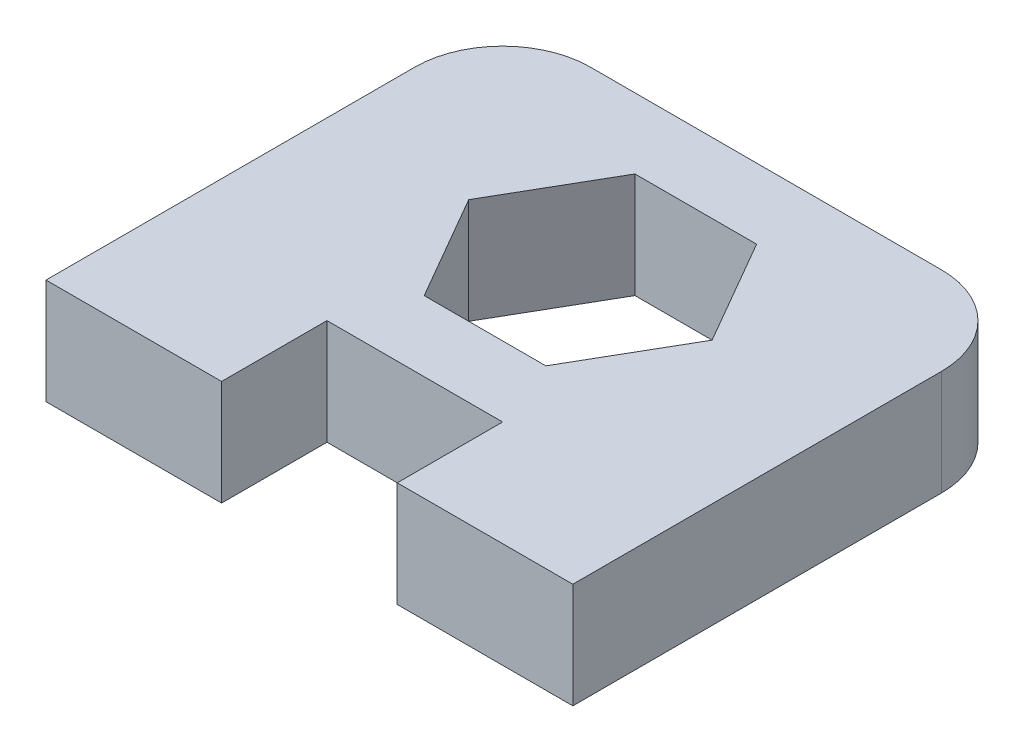
from build123d import *

# Parameters (mm, degrees)
BOSS_EXTRUDE1_DEPTH = 3


with BuildPart() as part:
    # Sketch1 → Boss-Extrude1 (new body)
    with BuildSketch(Plane(origin=(0, 0, 0), x_dir=(1, 0, 0), z_dir=(0, 1, 0))):
        with BuildLine():
            Line((0, 0), (0, 10.5))
            ThreePointArc((0, 10.5), (0.732233047, 12.267766953), (2.5, 13))
            Line((2.5, 13), (12.5, 13))
            ThreePointArc((12.5, 13), (14.267766953, 12.267766953), (15, 10.5))
            Line((15, 10.5), (15, 0))
            Line((15, 0), (10, 0))
            Line((10, 0), (10, 3))
            Line((10, 3), (5, 3))
            Line((5, 3), (5, 0))
            Line((5, 0), (0, 0))
        make_face()
        Polygon((5.767949192, 5), (9.232050808, 5), (10.964101615, 8), (9.232050808, 11), (5.767949192, 11), (4.035898385, 8), align=None, mode=Mode.SUBTRACT)
    extrude(amount=BOSS_EXTRUDE1_DEPTH)


solid = part.part
